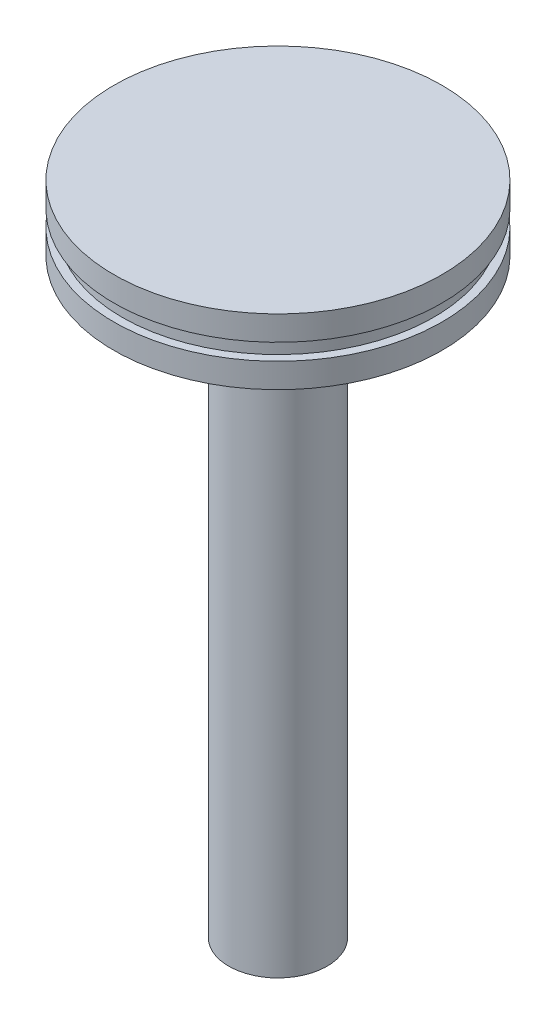
from build123d import *

# Parameters (mm, degrees)
CONG_1_R       = 0.5
ECHELLE1_SCALE = 0.578571429


with BuildPart() as part:
    # Esquisse1 → Révolution1 (revolve)
    with BuildSketch(Plane.XY, mode=Mode.PRIVATE) as r_volution1_sk:
        Polygon((0, 20), (5, 20), (5, 19.25), (4.75, 19.25), (4.75, 18.75), (5, 18.75), (5, 18), (1.5, 18), (1.5, 0), (0, 0), align=None)
    revolve(r_volution1_sk.sketch.rotate(Axis((0, 0, 0), (0, 1, 0)), 90), axis=Axis((0, 0, 0), (0, 1, 0)))

    # Congé1
    cong_1_edges = [part.edges().sort_by_distance(p)[0] for p in [
        (0, 18, 1.5),
    ]]
    fillet(cong_1_edges, radius=CONG_1_R)


with BuildPart() as part_1:
    # Echelle1: scaled about (0, 14.470399807, 0)
    add(part.part.scale(ECHELLE1_SCALE).moved(Location((0, 6.098239919, 0))))


solid = part_1.part
